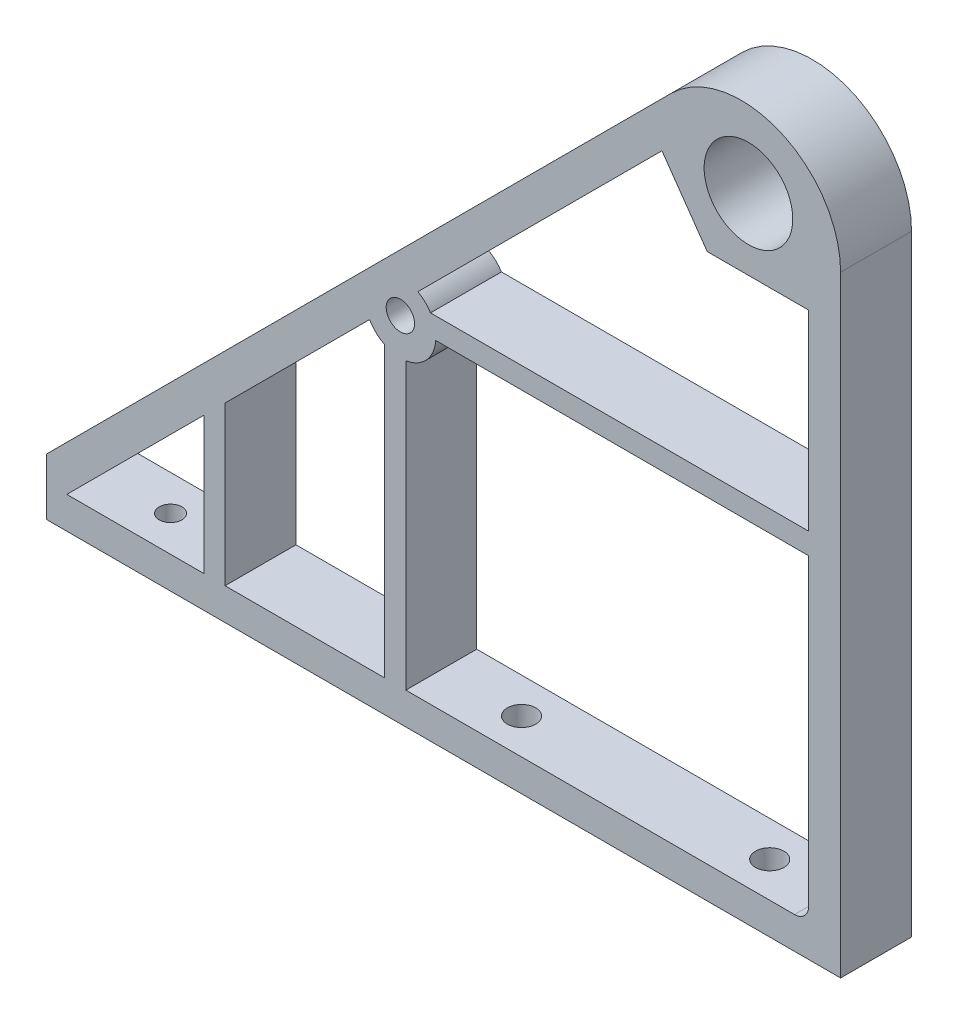
from build123d import *

# Parameters (mm, degrees)
BOSS_EXTRUDE1_DEPTH = 12.7
FILLET1_R           = 17.78
SKETCH2_R           = 7.9375
CUT_EXTRUDE1_DEPTH  = 25.4
SKETCH4_W           = 72.158320094
SKETCH4_H           = 56.919449397
CUT_EXTRUDE2_DEPTH  = 24.638
SKETCH5_R           = 2.032
CUT_EXTRUDE3_DEPTH  = 12.7
SKETCH6_R           = 4.1275
CUT_EXTRUDE4_DEPTH  = 32.258
SKETCH7_R           = 2.54
CUT_EXTRUDE5_DEPTH  = 12.7
FILLET2_R           = 2.54
SKETCH8_R           = 6.35
BOSS_EXTRUDE2_DEPTH = 12.7
SKETCH9_R           = 2.54
CUT_EXTRUDE6_DEPTH  = 12.7


with BuildPart() as part:
    # Sketch1 → Boss-Extrude1 (new body)
    with BuildSketch(Plane.XY):
        Polygon((-152.4, 0), (0, 0), (0, 152.4), align=None)
    extrude(amount=BOSS_EXTRUDE1_DEPTH)

    # Fillet1
    fillet1_edges = [part.edges().sort_by_distance(p)[0] for p in [
        (0, 152.4, 6.35),
    ]]
    fillet(fillet1_edges, radius=FILLET1_R)

    # Sketch2 → Cut-Extrude1 (cut)
    with BuildSketch(Plane.XY.offset(12.7)):
        with Locations((-16.51, 113.439359697)):
            Circle(SKETCH2_R)
        Polygon((-142.24, 0), (-152.4, 0), (-142.24, 10.16), align=None)
    extrude(amount=-CUT_EXTRUDE1_DEPTH, mode=Mode.SUBTRACT)

    # Sketch4 → Cut-Extrude2 (cut)
    with BuildSketch(Plane.XY):
        Polygon((-138.602769491, 5.715), (-114.068320094, 5.715), (-114.068320094, 30.249449397), align=None)
        Polygon((-110.258320094, 5.715), (-110.258320094, 34.059449397), (-81.683320094, 62.634449397), (-81.683320094, 5.715), align=None)
        Polygon((-77.873320094, 66.444449397), (-5.715, 66.444449397), (-5.715, 100.734449397), (-23.892955176, 100.734449397), (-32.002166338, 112.315603153), align=None)
        with Locations((-41.794160047, 34.174724699)):
            Rectangle(SKETCH4_W, SKETCH4_H)
    extrude(amount=CUT_EXTRUDE2_DEPTH, mode=Mode.SUBTRACT)

    # Sketch5 → Cut-Extrude3 (cut)
    with BuildSketch(Plane(origin=(0, 5.715, 0), x_dir=(1, 0, 0), z_dir=(0, 1, 0))):
        with Locations((-126.365, -6.35)):
            Circle(SKETCH5_R)
    extrude(amount=-CUT_EXTRUDE3_DEPTH, mode=Mode.SUBTRACT)

    # Sketch6 → Cut-Extrude4 (cut)
    with BuildSketch(Plane(origin=(0, 5.715, 0), x_dir=(1, 0, 0), z_dir=(0, 1, 0))):
        with Locations((-126.365, -6.35)):
            Circle(SKETCH6_R)
    extrude(amount=CUT_EXTRUDE4_DEPTH, mode=Mode.SUBTRACT)

    # Sketch7 → Cut-Extrude5 (cut)
    with BuildSketch(Plane(origin=(0, 5.715, 0), x_dir=(1, 0, 0), z_dir=(0, 1, 0))):
        with Locations((-19.05, -6.35)):
            Circle(SKETCH7_R)
        with Locations((-63.5, -6.35)):
            Circle(SKETCH7_R)
    extrude(amount=-CUT_EXTRUDE5_DEPTH, mode=Mode.SUBTRACT)

    # Fillet2
    fillet2_edges = [part.edges().sort_by_distance(p)[0] for p in [
        (-5.715, 5.715, 6.35),
    ]]
    fillet(fillet2_edges, radius=FILLET2_R)

    # Sketch8 → Boss-Extrude2 (add)
    with BuildSketch(Plane.XY.offset(12.7)):
        with Locations((-78.848031384, 63.088562946)):
            Circle(SKETCH8_R)
    extrude(amount=-BOSS_EXTRUDE2_DEPTH)

    # Sketch9 → Cut-Extrude6 (cut)
    with BuildSketch(Plane.XY.offset(12.7)):
        with Locations((-78.853278111, 63.331259387)):
            Circle(SKETCH9_R)
    extrude(amount=-CUT_EXTRUDE6_DEPTH, mode=Mode.SUBTRACT)


solid = part.part
